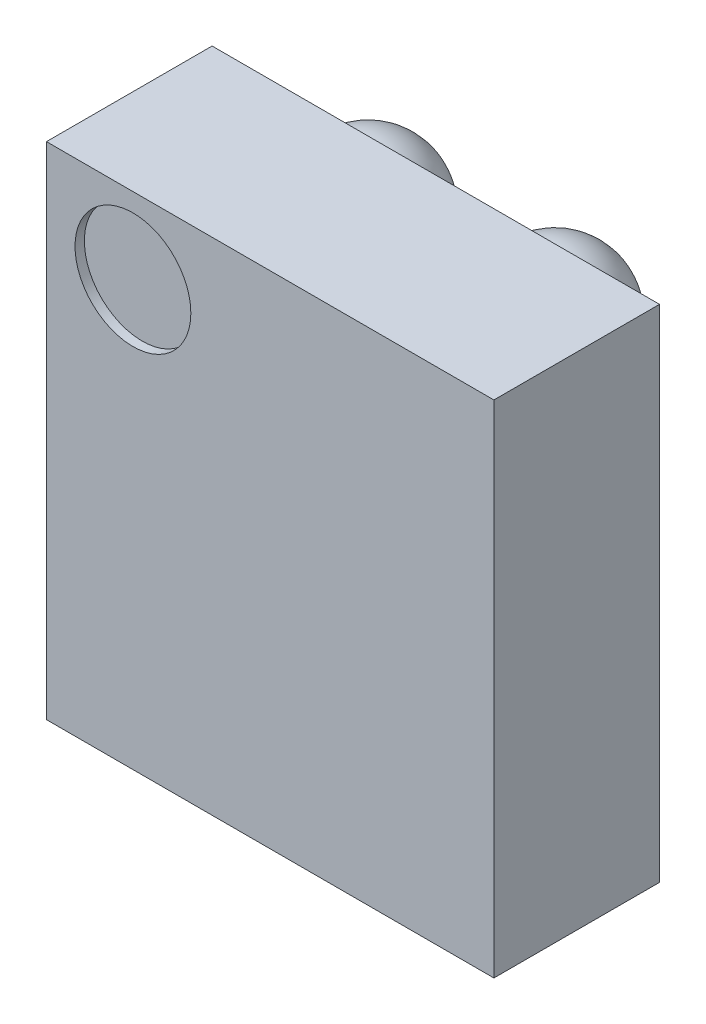
from build123d import *

# Parameters (mm, degrees)
BOSS_EXTRUDE1_START  = 0.19
SKETCH1_W            = 0.959
SKETCH1_H            = 1.073
BOSS_EXTRUDE1_DEPTH  = 0.355
LPATTERN1_COUNT      = 2
LPATTERN1_PITCH      = 0.3465
LPATTERN1_COUNT_DIR2 = 2
LPATTERN1_PITCH_DIR2 = 0.2
SKETCH3_R            = 0.124110004
CUT_EXTRUDE3_DEPTH   = 0.02


with BuildPart() as part:
    # Sketch1 → Boss-Extrude1 (new body)
    with BuildSketch(Plane.XY.offset(BOSS_EXTRUDE1_START)):
        Rectangle(SKETCH1_W, SKETCH1_H)
    extrude(amount=BOSS_EXTRUDE1_DEPTH)

    # Sketch2 → Revolve1 (revolve)
    with BuildSketch(Plane(origin=(0, 0, 0), x_dir=(1, 0, 0), z_dir=(0, 1, 0))):
        with BuildLine():
            Line((0, 0), (0, -0.27))
            ThreePointArc((0, -0.27), (0.135, -0.135), (0, 0))
        make_face()
    revolve1 = revolve(axis=Axis((0, 0, 0), (0, 0, 1)))

    # LPattern1: Revolve1 2 × 2, 2 skipped
    with Locations(*[(j * LPATTERN1_PITCH_DIR2, i * LPATTERN1_PITCH, 0) for i in range(LPATTERN1_COUNT) for j in range(LPATTERN1_COUNT_DIR2) if (i, j) not in ((0, 0), (0, 1), (1, 0))]):
        add(revolve1)

    # LPattern2 copy 1 sketch → LPattern2 copy 1 (revolve)
    with BuildSketch(Plane(origin=(-0.2, 0.3465, 0), x_dir=(1, 0, 0), z_dir=(0, 1, 0))):
        with BuildLine():
            Line((0, 0), (0, -0.27))
            ThreePointArc((0, -0.27), (0.135, -0.135), (0, 0))
        make_face()
    revolve(axis=Axis((-0.2, 0.3465, 0), (0, 0, 1)))

    # LPattern2 copy 2 sketch → LPattern2 copy 2 (revolve)
    with BuildSketch(Plane(origin=(0.2, -0.3465, 0), x_dir=(1, 0, 0), z_dir=(0, 1, 0))):
        with BuildLine():
            Line((0, 0), (0, -0.27))
            ThreePointArc((0, -0.27), (0.135, -0.135), (0, 0))
        make_face()
    revolve(axis=Axis((0.2, -0.3465, 0), (0, 0, 1)))

    # LPattern2 copy 3 sketch → LPattern2 copy 3 (revolve)
    with BuildSketch(Plane(origin=(-0.2, -0.3465, 0), x_dir=(1, 0, 0), z_dir=(0, 1, 0))):
        with BuildLine():
            Line((0, 0), (0, -0.27))
            ThreePointArc((0, -0.27), (0.135, -0.135), (0, 0))
        make_face()
    revolve(axis=Axis((-0.2, -0.3465, 0), (0, 0, 1)))

    # Sketch3 → Cut-Extrude3 (cut)
    with BuildSketch(Plane.XY.offset(0.545)):
        with Locations((-0.294168663, 0.372880622)):
            Circle(SKETCH3_R)
    extrude(amount=-CUT_EXTRUDE3_DEPTH, mode=Mode.SUBTRACT)


solid = part.part
